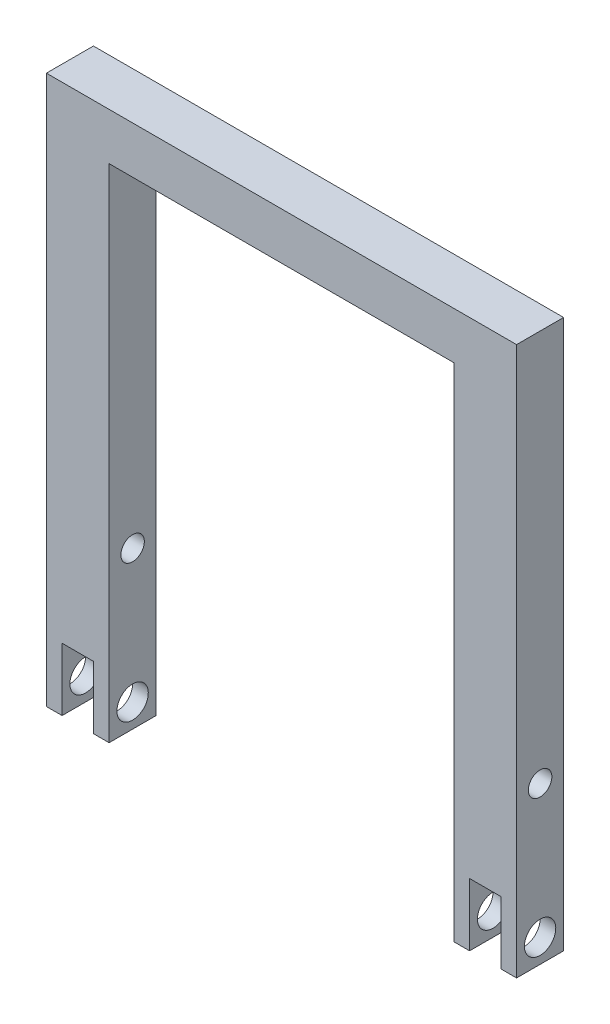
from build123d import *

# Parameters (mm, degrees)
SKETCH2_W           = 300
SKETCH2_H           = 350
BOSS_EXTRUDE1_DEPTH = 30
SKETCH3_W           = 220
SKETCH3_H           = 320
CUT_EXTRUDE1_DEPTH  = 236.67423904
SKETCH4_R           = 7.5
SKETCH4_R_2         = 10
CUT_EXTRUDE2_DEPTH  = 351.773925694
SKETCH7_W           = 20
SKETCH7_H           = 30
CUT_EXTRUDE3_DEPTH  = 40
SKETCH8_W           = 20
SKETCH8_H           = 30
CUT_EXTRUDE4_DEPTH  = 40


with BuildPart() as part:
    # Sketch2 → Boss-Extrude1 (new body)
    with BuildSketch(Plane.XY):
        with Locations((0, 4.282868526)):
            Rectangle(SKETCH2_W, SKETCH2_H)
    extrude(amount=BOSS_EXTRUDE1_DEPTH)

    # Sketch3 → Cut-Extrude1 (cut, through all)
    with BuildSketch(Plane.XY.offset(30)):
        with Locations((0, -10.717131474)):
            Rectangle(SKETCH3_W, SKETCH3_H)
    extrude(amount=-CUT_EXTRUDE1_DEPTH, mode=Mode.SUBTRACT)

    # Sketch4 → Cut-Extrude2 (cut, through all)
    with BuildSketch(Plane.ZY.offset(150)):
        with Locations(Location((15, -70.717131474, 0), (0, 0, 270))):
            Circle(SKETCH4_R)
        with Locations(Location((15, -155.717131474, 0), (0, 0, 270))):
            Circle(SKETCH4_R_2)
    extrude(amount=-CUT_EXTRUDE2_DEPTH, mode=Mode.SUBTRACT)

    # Sketch7 → Cut-Extrude3 (cut)
    with BuildSketch(Plane.XZ.offset(170.717131474)):
        with Locations((-130, 15)):
            Rectangle(SKETCH7_W, SKETCH7_H)
    extrude(amount=-CUT_EXTRUDE3_DEPTH, mode=Mode.SUBTRACT)

    # Sketch8 → Cut-Extrude4 (cut)
    with BuildSketch(Plane.XZ.offset(170.717131474)):
        with Locations((130, 15)):
            Rectangle(SKETCH8_W, SKETCH8_H)
    extrude(amount=-CUT_EXTRUDE4_DEPTH, mode=Mode.SUBTRACT)


solid = part.part
